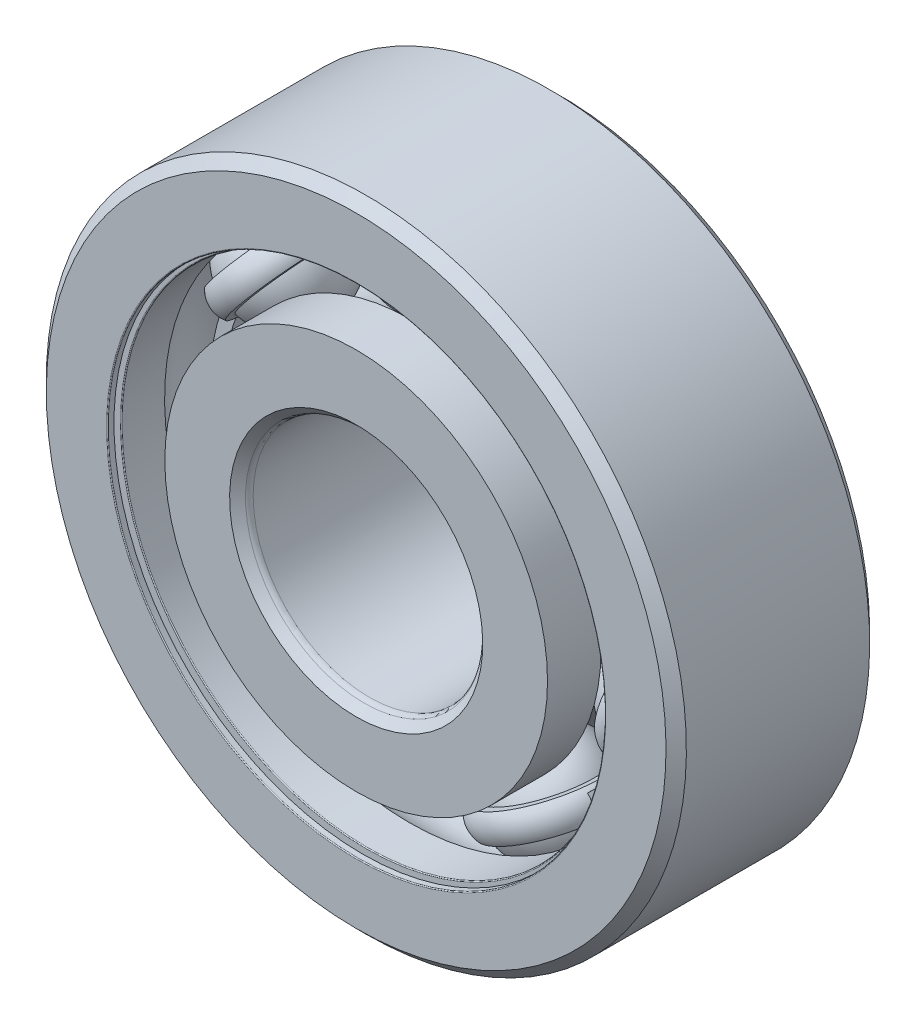
from build123d import *

# Parameters (mm, degrees)
BOSS_EXTRUDE1_DEPTH = 0.583333333
CIRPATTERN1_COUNT   = 7
CIRPATTERN2_COUNT   = 7
FILLET1_R           = 0.0315
FILLET2_R           = 0.2625


with BuildPart() as part:
    # Sketch3 → Revolve1 (revolve)
    with BuildSketch(Plane(origin=(0, 0, 0), x_dir=(0, 0, -1), z_dir=(1, 0, 0)), mode=Mode.PRIVATE) as revolve1_sk:
        with BuildLine():
            Line((3.15, 11), (3.5, 10.65))
            Line((3.5, 10.65), (3.5, 8.423076923))
            Line((3.5, 8.423076923), (1.6625, 8.423076923))
            ThreePointArc((1.6625, 8.423076923), (0, 9.401572312), (-1.6625, 8.423076923))
            Line((-1.6625, 8.423076923), (-3.5, 8.423076923))
            Line((-3.5, 8.423076923), (-3.5, 10.65))
            Line((-3.5, 10.65), (-3.15, 11))
            Line((-3.15, 11), (3.15, 11))
        make_face()
    revolve(revolve1_sk.sketch.rotate(Axis((0, 0, 3.5), (0, 0, -1)), 180), axis=Axis((0, 0, 3.5), (0, 0, -1)))

    # Sketch8 → Cut-Revolve1 (revolve, cut)
    with BuildSketch(Plane(origin=(0, 0, 0), x_dir=(0, 0, -1), z_dir=(1, 0, 0)), mode=Mode.PRIVATE) as cut_revolve1_sk:
        Polygon((-3.276, 8.423076923), (-3.15, 8.423076923), (-3.15, 9.282051282), (-3.276, 9.282051282), (-3.276, 8.549076923), (-3.5, 8.549076923), (-3.5, 8.423076923), align=None)
        Polygon((3.15, 8.423076923), (3.276, 8.423076923), (3.5, 8.423076923), (3.5, 8.549076923), (3.276, 8.549076923), (3.276, 9.282051282), (3.15, 9.282051282), align=None)
    revolve(cut_revolve1_sk.sketch.rotate(Axis((0, 0, 3.5), (0, 0, -1)), 180), axis=Axis((0, 0, 3.5), (0, 0, -1)), mode=Mode.SUBTRACT)

    # Fillet1
    fillet1_edges = [part.edges().sort_by_distance(p)[0] for p in [
        (0, 8.549076923, 3.5),
        (0, 8.423076923, 3.15),
        (0, 8.549076923, -3.5),
        (0, 8.423076923, -3.15),
    ]]
    fillet(fillet1_edges, radius=FILLET1_R)


with BuildPart() as body_2:
    # Sketch4 → Revolve2 (revolve)
    with BuildSketch(Plane(origin=(0, 0, 0), x_dir=(0, 0, -1), z_dir=(1, 0, 0)), mode=Mode.PRIVATE) as revolve2_sk:
        with BuildLine():
            Line((-3.15, 4), (-3.5, 4.35))
            Line((-3.5, 4.35), (-3.5, 6.576923077))
            Line((-3.5, 6.576923077), (-1.6625, 6.576923077))
            ThreePointArc((-1.6625, 6.576923077), (0, 5.598427688), (1.6625, 6.576923077))
            Line((1.6625, 6.576923077), (3.5, 6.576923077))
            Line((3.5, 6.576923077), (3.5, 4.35))
            Line((3.5, 4.35), (3.15, 4))
            Line((3.15, 4), (-3.15, 4))
        make_face()
    revolve(revolve2_sk.sketch.rotate(Axis((0, 0, 3.5), (0, 0, -1)), 180), axis=Axis((0, 0, 3.5), (0, 0, -1)))

    # Fillet2
    fillet2_edges = [body_2.edges().sort_by_distance(p)[0] for p in [
        (0, 4, 3.15),
        (0, 4, -3.15),
    ]]
    fillet(fillet2_edges, radius=FILLET2_R)


with BuildPart() as body_3:
    # Sketch5 → Revolve3 (revolve)
    with BuildSketch(Plane(origin=(0, 0, 0), x_dir=(0, 0, -1), z_dir=(1, 0, 0))):
        with BuildLine():
            Line((-1.901572312, 7.5), (1.901572312, 7.5))
            ThreePointArc((1.901572312, 7.5), (0, 9.401572312), (-1.901572312, 7.5))
        make_face()
    revolve(axis=Axis((0, 7.5, 1.901572312), (0, 0, -1)))


with BuildPart() as body_4:
    # Sketch6 → Revolve4 (revolve)
    with BuildSketch(Plane(origin=(0, 0, 0), x_dir=(0, 0, -1), z_dir=(1, 0, 0))):
        with BuildLine():
            Line((-1.844711225, 7.961538462), (-2.120592688, 7.961538462))
            ThreePointArc((-2.120592688, 7.961538462), (-2.258533419, 7.5), (-2.120592688, 7.038461538))
            Line((-2.120592688, 7.038461538), (-1.844711225, 7.038461538))
            ThreePointArc((-1.844711225, 7.038461538), (-1.901572312, 7.5), (-1.844711225, 7.961538462))
        make_face()
    revolve4 = revolve(axis=Axis((0, 11, 0), (0, -1, 0)))

    # Sketch7 → Boss-Extrude1 (add, symmetric)
    with BuildSketch(Plane.XY):
        with BuildLine():
            Line((5.705056266, 4.868504185), (6.056136652, 5.168104442))
            ThreePointArc((6.056136652, 5.168104442), (3.334668828, 7.229528234), (0, 7.961538462))
            Line((0, 7.961538462), (0, 7.5))
            ThreePointArc((0, 7.5), (3.141354693, 6.810425148), (5.705056266, 4.868504185))
        make_face()
    boss_extrude1 = extrude(amount=BOSS_EXTRUDE1_DEPTH, both=True)

    # CirPattern2: Revolve4, Boss-Extrude1 ×7 about axis
    cirpattern2_axis = Axis((0, 0, 0), (0, 0, 1))
    add([revolve4.rotate(cirpattern2_axis, i * 360 / CIRPATTERN2_COUNT) for i in range(1, CIRPATTERN2_COUNT)])
    add([boss_extrude1.rotate(cirpattern2_axis, i * 360 / CIRPATTERN2_COUNT) for i in range(1, CIRPATTERN2_COUNT)])


with BuildPart() as cirpattern1_1:
    # CirPattern1: pattern copy
    add(body_3.part.rotate(Axis((0, 0, 0), (0, 0, 1)), 1 * 360 / CIRPATTERN1_COUNT))


with BuildPart() as cirpattern1_2:
    # CirPattern1: pattern copy
    add(body_3.part.rotate(Axis((0, 0, 0), (0, 0, 1)), 2 * 360 / CIRPATTERN1_COUNT))


with BuildPart() as cirpattern1_3:
    # CirPattern1: pattern copy
    add(body_3.part.rotate(Axis((0, 0, 0), (0, 0, 1)), 3 * 360 / CIRPATTERN1_COUNT))


with BuildPart() as cirpattern1_4:
    # CirPattern1: pattern copy
    add(body_3.part.rotate(Axis((0, 0, 0), (0, 0, 1)), 4 * 360 / CIRPATTERN1_COUNT))


with BuildPart() as cirpattern1_5:
    # CirPattern1: pattern copy
    add(body_3.part.rotate(Axis((0, 0, 0), (0, 0, 1)), 5 * 360 / CIRPATTERN1_COUNT))


with BuildPart() as cirpattern1_6:
    # CirPattern1: pattern copy
    add(body_3.part.rotate(Axis((0, 0, 0), (0, 0, 1)), 6 * 360 / CIRPATTERN1_COUNT))


solid = Compound([part.part, body_2.part, body_3.part, body_4.part, cirpattern1_1.part, cirpattern1_2.part, cirpattern1_3.part, cirpattern1_4.part, cirpattern1_5.part, cirpattern1_6.part])
